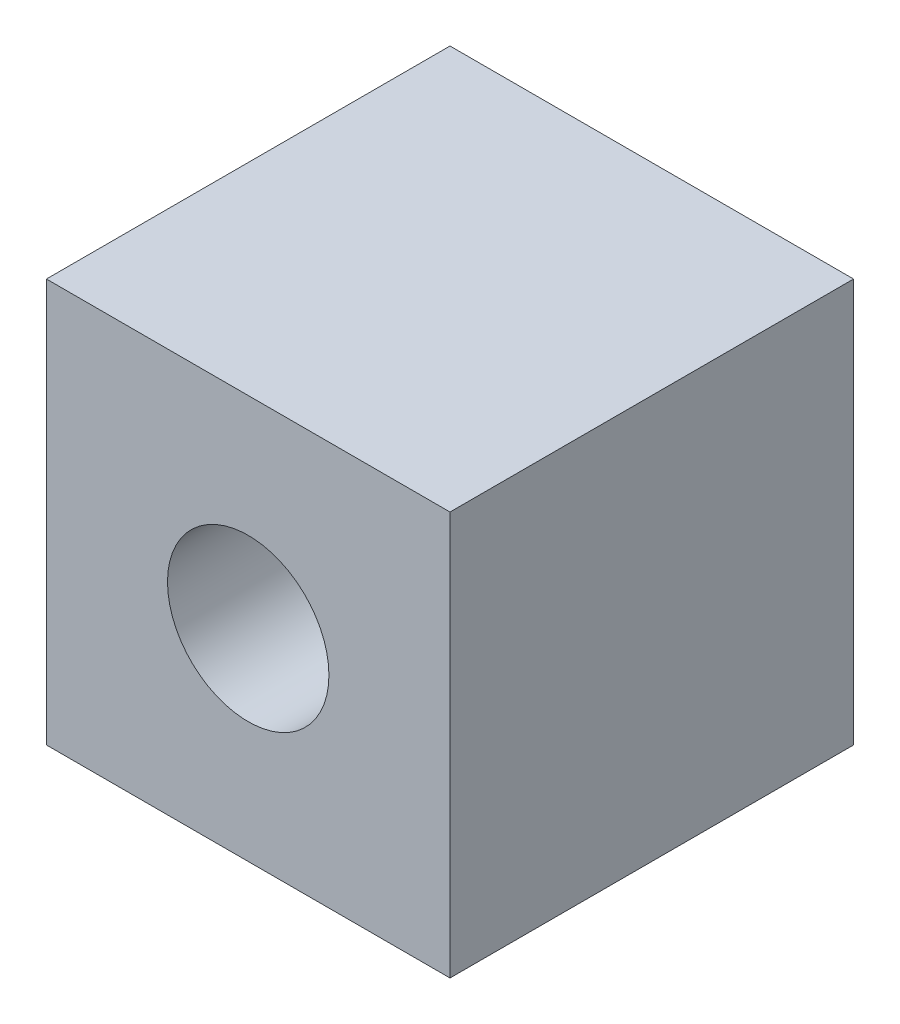
from build123d import *

# Parameters (mm, degrees)
SKETCH1_W           = 10
SKETCH1_H           = 10
BOSS_EXTRUDE1_DEPTH = 10
SKETCH2_R           = 2
CUT_EXTRUDE1_DEPTH  = 18.320508076


with BuildPart() as part:
    # Sketch1 → Boss-Extrude1 (new body)
    with BuildSketch(Plane.XY):
        with Locations((5, 5)):
            Rectangle(SKETCH1_W, SKETCH1_H)
    extrude(amount=BOSS_EXTRUDE1_DEPTH)

    # Sketch2 → Cut-Extrude1 (cut, through all)
    with BuildSketch(Plane.XY):
        with Locations((5, 5)):
            Circle(SKETCH2_R)
    extrude(amount=CUT_EXTRUDE1_DEPTH, mode=Mode.SUBTRACT)


solid = part.part
